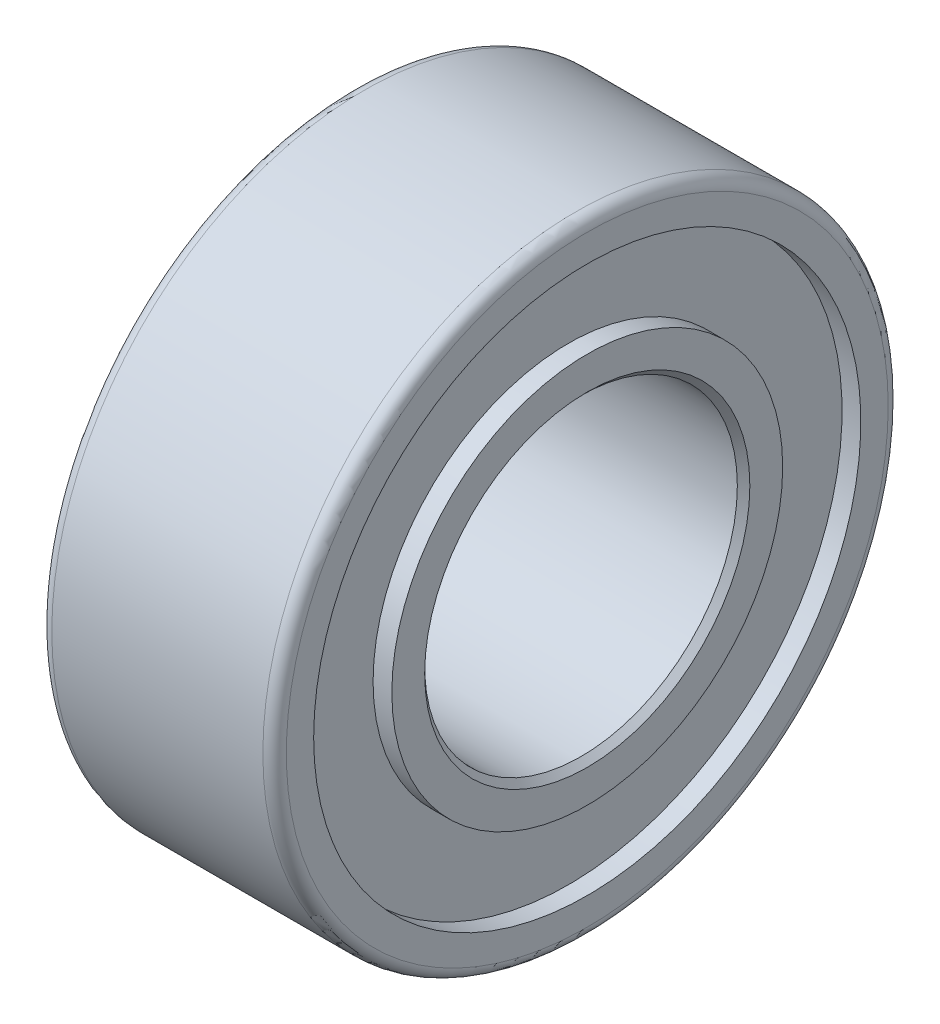
from build123d import *

# Parameters (mm, degrees)
SKETCH1_R           = 6.35
BOSS_EXTRUDE1_DEPTH = 4.7625
SKETCH2_R           = 3.175
CUT_EXTRUDE1_DEPTH  = 11.164959727
SKETCH3_R           = 5.55625
SKETCH3_R_2         = 3.96875
CUT_EXTRUDE2_DEPTH  = 0.381
CUT_EXTRUDE3_START  = -0.381
SKETCH4_R           = 5.55625
SKETCH4_R_2         = 3.96875
CUT_EXTRUDE3_DEPTH  = 0.381
CHAMFER1_SIZE       = 0.127
FILLET1_R           = 0.238125


with BuildPart() as part:
    # Sketch1 → Boss-Extrude1 (new body)
    with BuildSketch(Plane(origin=(-2.38125, 0, 0), x_dir=(0, -1, 0), z_dir=(-1, 0, 0))):
        with Locations(Location((0, 0, 0), (0, 0, 90))):
            Circle(SKETCH1_R)
    extrude(amount=-BOSS_EXTRUDE1_DEPTH)

    # Sketch2 → Cut-Extrude1 (cut, through all)
    with BuildSketch(Plane(origin=(2.38125, 0, 0), x_dir=(0, 0, -1), z_dir=(1, 0, 0))):
        Circle(SKETCH2_R)
    extrude(amount=-CUT_EXTRUDE1_DEPTH, mode=Mode.SUBTRACT)

    # Sketch3 → Cut-Extrude2 (cut)
    with BuildSketch(Plane.ZY.offset(2.38125)):
        with Locations(Location((0, 0, 0), (0, 0, 180))):
            Circle(SKETCH3_R)
        with Locations(Location((0, 0, 0), (0, 0, 180))):
            Circle(SKETCH3_R_2, mode=Mode.SUBTRACT)
    extrude(amount=-CUT_EXTRUDE2_DEPTH, mode=Mode.SUBTRACT)

    # Sketch4 → Cut-Extrude3 (cut)
    with BuildSketch(Plane(origin=(2.38125, 0, 0), x_dir=(0, 0, -1), z_dir=(1, 0, 0)).offset(CUT_EXTRUDE3_START)):
        Circle(SKETCH4_R)
        Circle(SKETCH4_R_2, mode=Mode.SUBTRACT)
    extrude(amount=CUT_EXTRUDE3_DEPTH, mode=Mode.SUBTRACT)

    # Chamfer1
    chamfer1_edges = [part.edges().sort_by_distance(p)[0] for p in [
        (-2.38125, 0, 3.175),
        (2.38125, 0, 3.175),
    ]]
    chamfer(chamfer1_edges, length=CHAMFER1_SIZE)

    # Fillet1
    fillet1_edges = [part.edges().sort_by_distance(p)[0] for p in [
        (-2.38125, 0, -6.35),
        (2.38125, 0, -6.35),
    ]]
    fillet(fillet1_edges, radius=FILLET1_R)


solid = part.part
